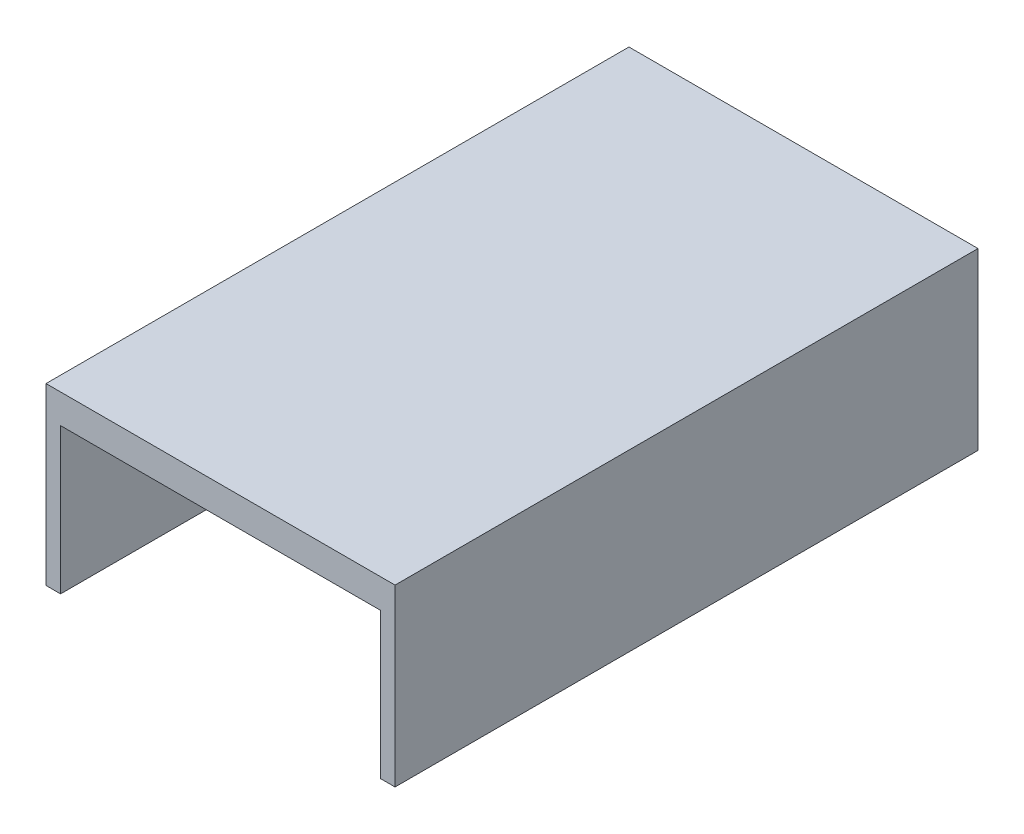
from build123d import *

# Parameters (mm, degrees)
SALIENTE_EXTRUIR1_DEPTH = 200


with BuildPart() as part:
    # Croquis1 → Saliente-Extruir1 (new body)
    with BuildSketch(Plane.XY):
        Polygon((0, 0), (-59.877040429, 0), (-59.877040429, -60), (-54.877040429, -60), (-54.877040429, -10), (54.877040429, -10), (54.877040429, -60), (59.877040429, -60), (59.877040429, 0), align=None)
    extrude(amount=-SALIENTE_EXTRUIR1_DEPTH)


solid = part.part
